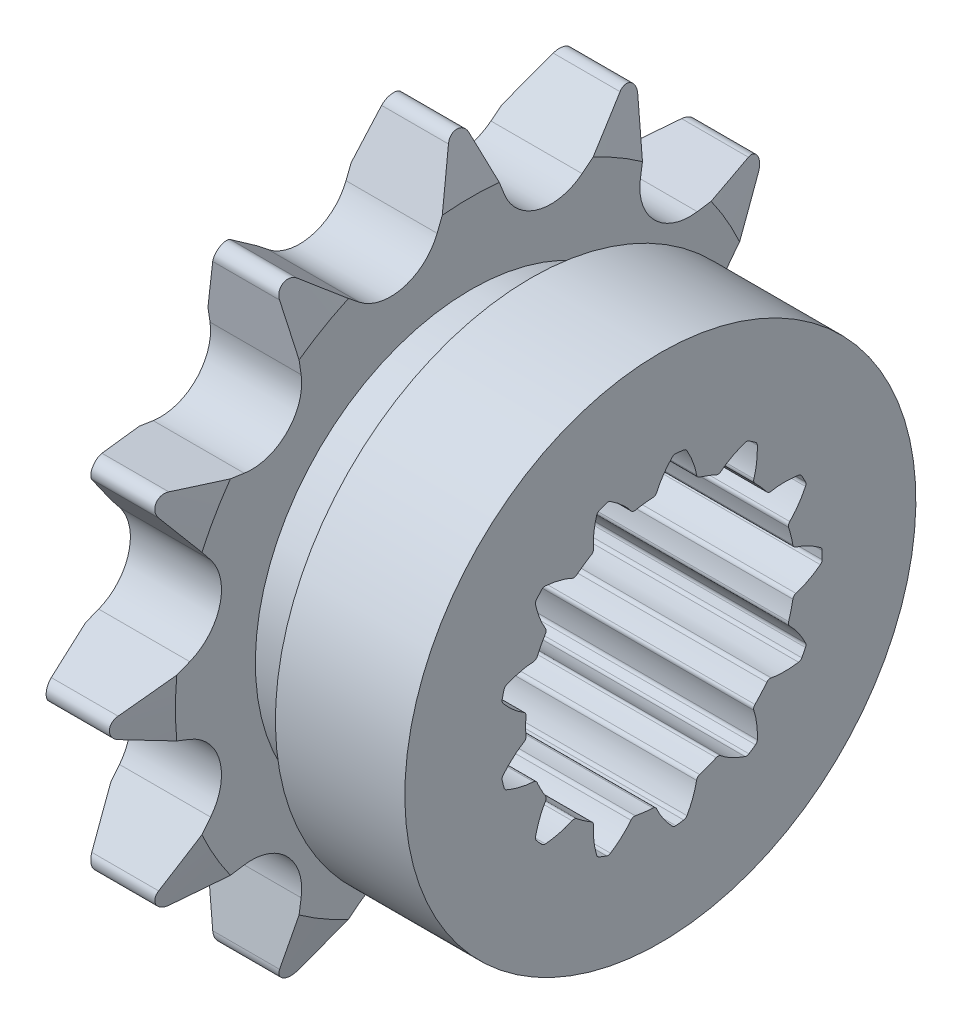
from build123d import *

# Parameters (mm, degrees)
SKETCH13_W            = 22.225
SKETCH13_H            = 27.5082
CUT_EXTRUDE1_DEPTH    = 7.2136
CIRPATTERN1_COUNT     = 12
SKETCH15_W            = 127
SKETCH15_H            = 22.5171
SKETCH16_W            = 4.7625
SKETCH16_H            = 3.175
SPLINE_CUT_DEPTH      = 45.803490606
SPLINE_CUT_DEPTH_BACK = 45.803490606


with BuildPart() as part:
    # Sketch13 → Revolve1 (revolve)
    with BuildSketch(Plane.XY):
        with Locations((11.1125, 13.7541)):
            Rectangle(SKETCH13_W, SKETCH13_H)
    revolve(axis=Axis((0, 0, 0), (-1, 0, 0)))

    # Sketch6 → Cut-Extrude1 (cut)
    with BuildSketch(Plane(origin=(0, -16.51, 0), x_dir=(0, 0, -1), z_dir=(1, 0, 0))):
        with BuildLine():
            Line((-0.805715716, 43.469749783), (-2.663822441, 38.756002806))
            ThreePointArc((-2.663822441, 38.756002806), (-5.324614334, 36.381731224), (-8.816063498, 37.107514783))
            Line((-8.816063498, 37.107514783), (-12.782104613, 40.260686049))
            ThreePointArc((-12.782104613, 40.260686049), (-13.256994885, 40.44645554), (-13.7541, 40.332800012))
            ThreePointArc((-13.7541, 40.332800012), (-7.119646056, 43.080880815), (0, 44.0182))
            ThreePointArc((0, 44.0182), (-0.487333422, 43.868076017), (-0.805715716, 43.469749783))
        make_face()
    cut_extrude1 = extrude(amount=CUT_EXTRUDE1_DEPTH, mode=Mode.SUBTRACT)

    # CirPattern1: Cut-Extrude1 ×12 about axis
    cirpattern1_axis = Axis((0, 0, 0), (1, 0, 0))
    for i in range(1, CIRPATTERN1_COUNT):
        add(cut_extrude1.rotate(cirpattern1_axis, i * 360 / CIRPATTERN1_COUNT), mode=Mode.SUBTRACT)

    # Sketch15 → hub Cut-Revolve3 (revolve, cut)
    with BuildSketch(Plane.XY):
        with Locations((70.7136, 31.48965)):
            Rectangle(SKETCH15_W, SKETCH15_H)
        with Locations((-63.5, 31.48965)):
            Rectangle(SKETCH15_W, SKETCH15_H)
    revolve(axis=Axis((0, 0, 0), (-1, 0, 0)), mode=Mode.SUBTRACT)

    # Sketch4 → Teeth Chamfer (revolve, cut)
    with BuildSketch(Plane.XY):
        Polygon((0, 27.5082), (1.104501883, 27.5082), (0, 23.386142857), align=None)
        Polygon((7.2136, 27.5082), (6.109098117, 27.5082), (7.2136, 23.386142857), align=None)
    revolve(axis=Axis((0, 0, 0), (-1, 0, 0)), mode=Mode.SUBTRACT)

    # Sketch16 → Recess (revolve, cut)
    with BuildSketch(Plane.XY):
        with Locations((9.59485, 18.6436)):
            Rectangle(SKETCH16_W, SKETCH16_H)
    revolve(axis=Axis((0, 0, 0), (-1, 0, 0)), mode=Mode.SUBTRACT)

    # Sketch31 → Spline Cut (cut, two sides: drawn at the far end of the back side and taken through both)
    with BuildSketch(Plane.ZY.offset(-SPLINE_CUT_DEPTH_BACK)):
        with BuildLine():
            ThreePointArc((9.096963927, -5.618057759), (9.432903718, -5.033652066), (9.731349847, -4.429238742))
            ThreePointArc((9.731349847, -4.429238742), (9.849186198, -4.242921184), (10.055031262, -4.164007003))
            add(Edge.make_bspline(
                [(10.055031262, -4.164007003), (10.154386976, -4.159463337), (10.336809192, -4.145821565), (10.601263254, -4.113038702), (10.945085741, -4.048420801), (11.269331323, -3.969271812), (11.618092873, -3.865601258), (11.882405473, -3.771842378), (12.065671025, -3.699742638), (12.17048809, -3.656196758)],
                knots=[0, 0, 0, 0, 0, 0.181968537, 0.334561157, 0.487153992, 0.639745397, 0.792336557, 1, 1, 1, 1, 1], degree=4, weights=[1, 1, 1, 1, 1, 1, 1, 1, 1, 1]))
            ThreePointArc((12.17048809, -3.656196758), (12.298958844, -3.564199425), (12.373875258, -3.425074393))
            ThreePointArc((12.373875258, -3.425074393), (12.453110239, -3.119814814), (12.524812347, -2.81269855))
            ThreePointArc((12.524812347, -2.81269855), (12.530965903, -2.775233666), (12.533025166, -2.737322676))
            ThreePointArc((12.533025166, -2.737322676), (12.512180636, -2.618340845), (12.452129872, -2.513531129))
            add(Edge.make_bspline(
                [(10.814977065, -1.08078568), (10.900840634, -1.130981798), (11.056027836, -1.227836819), (11.274955323, -1.379762533), (11.54936558, -1.59676112), (11.799688415, -1.817528504), (12.060323323, -2.071401795), (12.250788583, -2.277253351), (12.37955575, -2.426262248), (12.452129872, -2.513531129)],
                knots=[0, 0, 0, 0, 0, 0.181968537, 0.334561157, 0.487153992, 0.639745397, 0.792336557, 1, 1, 1, 1, 1], degree=4, weights=[1, 1, 1, 1, 1, 1, 1, 1, 1, 1]))
            ThreePointArc((10.814977065, -1.08078568), (10.682449044, -0.942686522), (10.642381645, -0.755524408))
            ThreePointArc((10.642381645, -0.755524408), (10.659820925, -0.403848256), (10.665636134, -0.051787995))
            ThreePointArc((10.665636134, -0.051787995), (10.659820925, 0.300272266), (10.642381645, 0.651948418))
            ThreePointArc((10.642381645, 0.651948418), (10.682449043, 0.839110529), (10.814977059, 0.977209687))
            add(Edge.make_bspline(
                [(10.814977059, 0.977209687), (10.900840628, 1.027405805), (11.056027831, 1.124260826), (11.274955318, 1.27618654), (11.549365574, 1.493185127), (11.799688409, 1.713952511), (12.060323317, 1.967825802), (12.250788577, 2.173677358), (12.379555744, 2.322686255), (12.452129867, 2.409955136)],
                knots=[0, 0, 0, 0, 0, 0.181968537, 0.334561157, 0.487153992, 0.639745397, 0.792336557, 1, 1, 1, 1, 1], degree=4, weights=[1, 1, 1, 1, 1, 1, 1, 1, 1, 1]))
            ThreePointArc((12.452129867, 2.409955136), (12.512180632, 2.514764857), (12.533025159, 2.633746695))
            ThreePointArc((12.533025159, 2.633746695), (12.530965896, 2.671657685), (12.524812341, 2.709122568))
            ThreePointArc((12.524812341, 2.709122568), (12.453110232, 3.016238833), (12.373875251, 3.321498411))
            ThreePointArc((12.373875251, 3.321498411), (12.298958837, 3.460623444), (12.170488083, 3.552620776))
            add(Edge.make_bspline(
                [(10.055031255, 4.060431021), (10.154386969, 4.055887356), (10.336809185, 4.042245584), (10.601263247, 4.009462721), (10.945085734, 3.944844819), (11.269331316, 3.865695831), (11.618092867, 3.762025276), (11.882405466, 3.668266396), (12.065671018, 3.596166656), (12.170488083, 3.552620776)],
                knots=[0, 0, 0, 0, 0, 0.181968537, 0.334561157, 0.487153992, 0.639745397, 0.792336557, 1, 1, 1, 1, 1], degree=4, weights=[1, 1, 1, 1, 1, 1, 1, 1, 1, 1]))
            ThreePointArc((10.055031255, 4.060431021), (9.873505642, 4.121122911), (9.75104915, 4.268226484))
            ThreePointArc((9.75104915, 4.268226484), (9.44459736, 4.902161031), (9.096963914, 5.514481778))
            ThreePointArc((9.096963914, 5.514481778), (9.045463263, 5.698825846), (9.098633115, 5.882695417))
            add(Edge.make_bspline(
                [(9.098633115, 5.882695417), (9.15133423, 5.967044663), (9.243734902, 6.124924613), (9.366982164, 6.361188829), (9.509116107, 6.68085634), (9.628170251, 6.992666973), (9.7409702, 7.338583689), (9.813954824, 7.609369809), (9.858724601, 7.801151721), (9.882429924, 7.912151354)],
                knots=[0, 0, 0, 0, 0, 0.181968537, 0.334561157, 0.487153992, 0.639745397, 0.792336557, 1, 1, 1, 1, 1], degree=4, weights=[1, 1, 1, 1, 1, 1, 1, 1, 1, 1]))
            ThreePointArc((9.882429924, 7.912151354), (9.888213448, 7.948497359), (9.890148422, 7.985249735))
            ThreePointArc((9.890148422, 7.985249735), (9.86890594, 8.10532677), (9.807757027, 8.21082818))
            ThreePointArc((9.807757027, 8.21082818), (9.601543918, 8.449444496), (9.389523627, 8.682916097))
            ThreePointArc((9.389523627, 8.682916097), (9.25853381, 8.771289802), (9.102025315, 8.793046058))
            add(Edge.make_bspline(
                [(6.992890131, 8.259587892), (7.082976794, 8.301737578), (7.250843292, 8.37443422), (7.500240691, 8.468304367), (7.834709819, 8.570870333), (8.158597393, 8.65147182), (8.515588518, 8.721753677), (8.793197627, 8.761566501), (8.988977633, 8.782893101), (9.102025315, 8.793046058)],
                knots=[0, 0, 0, 0, 0, 0.181968537, 0.334561157, 0.487153992, 0.639745397, 0.792336557, 1, 1, 1, 1, 1], degree=4, weights=[1, 1, 1, 1, 1, 1, 1, 1, 1, 1]))
            ThreePointArc((6.992890131, 8.259587892), (6.803952256, 8.228968733), (6.627159979, 8.302314108))
            ThreePointArc((6.627159979, 8.302314108), (6.06120632, 8.721220025), (5.468832551, 9.101849802))
            ThreePointArc((5.468832551, 9.101849802), (5.33756203, 9.241144822), (5.299193145, 9.428662504))
            add(Edge.make_bspline(
                [(5.299193145, 9.428662504), (5.306658616, 9.527841481), (5.315104876, 9.710577968), (5.314437452, 9.9770554), (5.291733909, 10.326159861), (5.252245491, 10.657581684), (5.191369372, 11.016296475), (5.130153463, 11.289983322), (5.080669632, 11.480603325), (5.050075552, 11.589905031)],
                knots=[0, 0, 0, 0, 0, 0.181968537, 0.334561157, 0.487153992, 0.639745397, 0.792336557, 1, 1, 1, 1, 1], degree=4, weights=[1, 1, 1, 1, 1, 1, 1, 1, 1, 1]))
            ThreePointArc((5.050075552, 11.589905031), (4.974234422, 11.728528142), (4.845153943, 11.819668001))
            ThreePointArc((4.845153943, 11.819668001), (4.551670772, 11.935120245), (4.255436465, 12.04331834))
            ThreePointArc((4.255436465, 12.04331834), (4.098381434, 12.060695366), (3.949689407, 12.00722645))
            add(Edge.make_bspline(
                [(2.330053321, 10.554708709), (2.390233163, 10.633895763), (2.505087752, 10.776276893), (2.682294549, 10.975295531), (2.930787473, 11.221548738), (3.180118298, 11.443435871), (3.463556634, 11.671569413), (3.690865349, 11.835833304), (3.854308971, 11.945700575), (3.949689407, 12.00722645)],
                knots=[0, 0, 0, 0, 0, 0.181968537, 0.334561157, 0.487153992, 0.639745397, 0.792336557, 1, 1, 1, 1, 1], degree=4, weights=[1, 1, 1, 1, 1, 1, 1, 1, 1, 1]))
            ThreePointArc((2.330053321, 10.554708709), (2.176986574, 10.439792982), (1.986359491, 10.422577618))
            ThreePointArc((1.986359491, 10.422577618), (1.290557128, 10.530488607), (0.589148727, 10.59222972))
            ThreePointArc((0.589148727, 10.59222972), (0.408180829, 10.654564882), (0.287063057, 10.802772633))
            add(Edge.make_bspline(
                [(0.287063057, 10.802772633), (0.247582634, 10.894060634), (0.170139547, 11.05979093), (0.045710334, 11.29543481), (-0.136629587, 11.594000596), (-0.325614245, 11.869108863), (-0.546220448, 12.158444493), (-0.727613063, 12.37233371), (-0.860014351, 12.518123057), (-0.9378991, 12.600687134)],
                knots=[0, 0, 0, 0, 0, 0.181968537, 0.334561157, 0.487153992, 0.639745397, 0.792336557, 1, 1, 1, 1, 1], degree=4, weights=[1, 1, 1, 1, 1, 1, 1, 1, 1, 1]))
            ThreePointArc((-0.9378991, 12.600687134), (-1.069474457, 12.688186671), (-1.226124349, 12.70890032))
            ThreePointArc((-1.226124349, 12.70890032), (-1.539644124, 12.674739775), (-1.852228739, 12.632877483))
            ThreePointArc((-1.852228739, 12.632877483), (-1.999369569, 12.575276963), (-2.106181575, 12.458831958))
            add(Edge.make_bspline(
                [(-2.865279455, 10.420008954), (-2.84879291, 10.518092574), (-2.813262034, 10.697540393), (-2.74884178, 10.95611475), (-2.643251794, 11.289641556), (-2.525596405, 11.601982666), (-2.380643166, 11.935705248), (-2.255708531, 12.186789328), (-2.162044258, 12.360028003), (-2.106181575, 12.458831958)],
                knots=[0, 0, 0, 0, 0, 0.181968537, 0.334561157, 0.487153992, 0.639745397, 0.792336557, 1, 1, 1, 1, 1], degree=4, weights=[1, 1, 1, 1, 1, 1, 1, 1, 1, 1]))
            ThreePointArc((-2.865279455, 10.420008954), (-2.947409327, 10.247122466), (-3.108200848, 10.143290196))
            ThreePointArc((-3.108200848, 10.143290196), (-3.774451981, 9.91548515), (-4.424210802, 9.644193453))
            ThreePointArc((-4.424210802, 9.644193453), (-4.613418511, 9.615288522), (-4.789538549, 9.690233734))
            add(Edge.make_bspline(
                [(-4.789538549, 9.690233734), (-4.866920376, 9.752717777), (-5.012511534, 9.863475068), (-5.232197301, 10.014302224), (-5.532401722, 10.193931511), (-5.827588513, 10.349702235), (-6.157386576, 10.503375397), (-6.417401036, 10.608467541), (-6.602388242, 10.676027651), (-6.709721201, 10.712939663)],
                knots=[0, 0, 0, 0, 0, 0.181968537, 0.334561157, 0.487153992, 0.639745397, 0.792336557, 1, 1, 1, 1, 1], degree=4, weights=[1, 1, 1, 1, 1, 1, 1, 1, 1, 1]))
            ThreePointArc((-6.709721201, 10.712939663), (-6.866888457, 10.729270538), (-7.01522116, 10.674812728))
            ThreePointArc((-7.01522116, 10.674812728), (-7.276953938, 10.498865164), (-7.534279491, 10.316532631))
            ThreePointArc((-7.534279491, 10.316532631), (-7.637797929, 10.19715015), (-7.678260572, 10.044405205))
            add(Edge.make_bspline(
                [(-7.40292007, 7.886346716), (-7.43390369, 7.980857128), (-7.485836221, 8.156262302), (-7.548960415, 8.415156109), (-7.610462761, 8.759549543), (-7.651436239, 9.090791046), (-7.678175138, 9.453650846), (-7.684235601, 9.734034777), (-7.681808034, 9.930957965), (-7.678260572, 10.044405205)],
                knots=[0, 0, 0, 0, 0, 0.181968537, 0.334561157, 0.487153992, 0.639745397, 0.792336557, 1, 1, 1, 1, 1], degree=4, weights=[1, 1, 1, 1, 1, 1, 1, 1, 1, 1]))
            ThreePointArc((-7.40292007, 7.886346716), (-7.389885405, 7.832521856), (-7.38550395, 7.777314784))
            ThreePointArc((-7.38550395, 7.777314784), (-7.412525738, 7.642462737), (-7.489418662, 7.528433224))
            ThreePointArc((-7.489418662, 7.528433224), (-7.973488458, 7.017099534), (-8.422745784, 6.474924686))
            ThreePointArc((-8.422745784, 6.474924686), (-8.576848099, 6.361401433), (-8.767623424, 6.34591506))
            add(Edge.make_bspline(
                [(-8.767623424, 6.34591506), (-8.865179412, 6.365280804), (-9.045565459, 6.395691931), (-9.31018042, 6.427149678), (-9.659476126, 6.446691562), (-9.993241314, 6.447439546), (-10.356678475, 6.430245572), (-10.6357486, 6.402465299), (-10.830943384, 6.376318964), (-10.943135867, 6.359122814)],
                knots=[0, 0, 0, 0, 0, 0.181968537, 0.334561157, 0.487153992, 0.639745397, 0.792336557, 1, 1, 1, 1, 1], degree=4, weights=[1, 1, 1, 1, 1, 1, 1, 1, 1, 1]))
            ThreePointArc((-10.943135867, 6.359122814), (-11.089889897, 6.30054382), (-11.195924177, 6.18339018))
            ThreePointArc((-11.195924177, 6.18339018), (-11.345910132, 5.905963062), (-11.48902644, 5.624930476))
            ThreePointArc((-11.48902644, 5.624930476), (-11.52520766, 5.471115122), (-11.490051435, 5.317062262))
            add(Edge.make_bspline(
                [(-10.243349742, 3.53415348), (-10.314705554, 3.603439488), (-10.442204376, 3.734618806), (-10.618412024, 3.934522612), (-10.832917256, 4.210886287), (-11.023133072, 4.485144748), (-11.215438548, 4.794014958), (-11.351105731, 5.039466162), (-11.440470995, 5.214961131), (-11.490051435, 5.317062262)],
                knots=[0, 0, 0, 0, 0, 0.181968537, 0.334561157, 0.487153992, 0.639745397, 0.792336557, 1, 1, 1, 1, 1], degree=4, weights=[1, 1, 1, 1, 1, 1, 1, 1, 1, 1]))
            ThreePointArc((-10.243349742, 3.53415348), (-10.164804896, 3.41936585), (-10.137168478, 3.283051063))
            ThreePointArc((-10.137168478, 3.283051063), (-10.141303219, 3.229411317), (-10.153609749, 3.177038922))
            ThreePointArc((-10.153609749, 3.177038922), (-10.344603652, 2.499316974), (-10.490440043, 1.810464698))
            ThreePointArc((-10.490440043, 1.810464698), (-10.57413398, 1.638329934), (-10.735860265, 1.535959717))
            add(Edge.make_bspline(
                [(-10.735860265, 1.535959717), (-10.831241512, 1.507770703), (-11.00509818, 1.450868843), (-11.254022236, 1.35575059), (-11.57238979, 1.210728261), (-11.868271791, 1.056282151), (-12.182088978, 0.872159973), (-12.416283165, 0.71787141), (-12.576968756, 0.60400844), (-12.668318816, 0.536643559)],
                knots=[0, 0, 0, 0, 0, 0.181968537, 0.334561157, 0.487153992, 0.639745397, 0.792336557, 1, 1, 1, 1, 1], degree=4, weights=[1, 1, 1, 1, 1, 1, 1, 1, 1, 1]))
            ThreePointArc((-12.668318816, 0.536643559), (-12.771040041, 0.416574438), (-12.810484721, 0.263563454))
            ThreePointArc((-12.810484721, 0.263563454), (-12.813394052, 0.105899652), (-12.814363878, -0.051788008))
            ThreePointArc((-12.814363878, -0.051788008), (-12.813394052, -0.209475668), (-12.810484721, -0.36713947))
            ThreePointArc((-12.810484721, -0.36713947), (-12.771040041, -0.520150453), (-12.668318816, -0.640219574))
            add(Edge.make_bspline(
                [(-10.735860265, -1.639535732), (-10.831241512, -1.611346719), (-11.00509818, -1.554444858), (-11.254022236, -1.459326606), (-11.57238979, -1.314304276), (-11.868271791, -1.159858167), (-12.182088978, -0.975735988), (-12.416283165, -0.821447425), (-12.576968756, -0.707584456), (-12.668318816, -0.640219574)],
                knots=[0, 0, 0, 0, 0, 0.181968537, 0.334561157, 0.487153992, 0.639745397, 0.792336557, 1, 1, 1, 1, 1], degree=4, weights=[1, 1, 1, 1, 1, 1, 1, 1, 1, 1]))
            ThreePointArc((-10.735860265, -1.639535732), (-10.574133976, -1.741905949), (-10.490440037, -1.914040716))
            ThreePointArc((-10.490440037, -1.914040716), (-10.344603646, -2.602892991), (-10.153609742, -3.280614939))
            ThreePointArc((-10.153609742, -3.280614939), (-10.141303212, -3.332987334), (-10.137168472, -3.38662708))
            ThreePointArc((-10.137168472, -3.38662708), (-10.164804889, -3.522941864), (-10.243349731, -3.637729493))
            add(Edge.make_bspline(
                [(-10.243349731, -3.637729493), (-10.314705544, -3.707015501), (-10.442204365, -3.838194818), (-10.618412013, -4.038098625), (-10.832917245, -4.3144623), (-11.023133061, -4.588720761), (-11.215438537, -4.897590971), (-11.351105721, -5.143042175), (-11.440470985, -5.318537144), (-11.490051425, -5.420638275)],
                knots=[0, 0, 0, 0, 0, 0.181968537, 0.334561157, 0.487153992, 0.639745397, 0.792336557, 1, 1, 1, 1, 1], degree=4, weights=[1, 1, 1, 1, 1, 1, 1, 1, 1, 1]))
            ThreePointArc((-11.490051425, -5.420638275), (-11.525207649, -5.574691135), (-11.489026429, -5.728506489))
            ThreePointArc((-11.489026429, -5.728506489), (-11.345910121, -6.009539075), (-11.195924166, -6.286966193))
            ThreePointArc((-11.195924166, -6.286966193), (-11.089889887, -6.404119833), (-10.943135857, -6.462698827))
            add(Edge.make_bspline(
                [(-8.767623413, -6.449491073), (-8.865179401, -6.468856817), (-9.045565449, -6.499267944), (-9.310180409, -6.530725691), (-9.659476115, -6.550267575), (-9.993241303, -6.551015559), (-10.356678464, -6.533821585), (-10.635748589, -6.506041312), (-10.830943374, -6.479894977), (-10.943135857, -6.462698827)],
                knots=[0, 0, 0, 0, 0, 0.181968537, 0.334561157, 0.487153992, 0.639745397, 0.792336557, 1, 1, 1, 1, 1], degree=4, weights=[1, 1, 1, 1, 1, 1, 1, 1, 1, 1]))
            ThreePointArc((-8.767623413, -6.449491073), (-8.576848085, -6.464977444), (-8.422745767, -6.578500698))
            ThreePointArc((-8.422745767, -6.578500698), (-7.973488441, -7.120675545), (-7.489418645, -7.632009235))
            ThreePointArc((-7.489418645, -7.632009235), (-7.412525721, -7.746038749), (-7.385503933, -7.880890795))
            ThreePointArc((-7.385503933, -7.880890795), (-7.389885388, -7.936097868), (-7.402920053, -7.989922727))
            add(Edge.make_bspline(
                [(-7.402920053, -7.989922727), (-7.433903673, -8.08443314), (-7.485836204, -8.259838314), (-7.548960398, -8.518732121), (-7.610462744, -8.863125554), (-7.651436222, -9.194367058), (-7.67817512, -9.557226858), (-7.684235584, -9.837610789), (-7.681808017, -10.034533976), (-7.678260555, -10.147981217)],
                knots=[0, 0, 0, 0, 0, 0.181968537, 0.334561157, 0.487153992, 0.639745397, 0.792336557, 1, 1, 1, 1, 1], degree=4, weights=[1, 1, 1, 1, 1, 1, 1, 1, 1, 1]))
            ThreePointArc((-7.678260555, -10.147981217), (-7.637797912, -10.300726162), (-7.534279474, -10.420108643))
            ThreePointArc((-7.534279474, -10.420108643), (-7.276953921, -10.602441175), (-7.015221143, -10.77838874))
            ThreePointArc((-7.015221143, -10.77838874), (-6.86688844, -10.83284655), (-6.709721184, -10.816515674))
            add(Edge.make_bspline(
                [(-4.789538532, -9.793809745), (-4.866920359, -9.856293788), (-5.012511517, -9.96705108), (-5.232197284, -10.117878235), (-5.532401705, -10.297507523), (-5.827588496, -10.453278246), (-6.157386559, -10.606951409), (-6.417401019, -10.712043553), (-6.602388225, -10.779603663), (-6.709721184, -10.816515674)],
                knots=[0, 0, 0, 0, 0, 0.181968537, 0.334561157, 0.487153992, 0.639745397, 0.792336557, 1, 1, 1, 1, 1], degree=4, weights=[1, 1, 1, 1, 1, 1, 1, 1, 1, 1]))
            ThreePointArc((-4.789538532, -9.793809745), (-4.613418492, -9.71886453), (-4.42421078, -9.747769461))
            ThreePointArc((-4.42421078, -9.747769461), (-3.774451958, -10.019061157), (-3.108200826, -10.246866204))
            ThreePointArc((-3.108200826, -10.246866204), (-2.947409307, -10.350698471), (-2.865279434, -10.523584955))
            add(Edge.make_bspline(
                [(-2.865279434, -10.523584955), (-2.848792889, -10.621668576), (-2.813262013, -10.801116394), (-2.748841759, -11.059690751), (-2.643251773, -11.393217557), (-2.525596384, -11.705558668), (-2.380643145, -12.03928125), (-2.25570851, -12.290365329), (-2.162044237, -12.463604005), (-2.106181554, -12.56240796)],
                knots=[0, 0, 0, 0, 0, 0.181968537, 0.334561157, 0.487153992, 0.639745397, 0.792336557, 1, 1, 1, 1, 1], degree=4, weights=[1, 1, 1, 1, 1, 1, 1, 1, 1, 1]))
            ThreePointArc((-2.106181554, -12.56240796), (-1.999369548, -12.678852964), (-1.852228718, -12.736453484))
            ThreePointArc((-1.852228718, -12.736453484), (-1.539644103, -12.778315776), (-1.226124328, -12.812476321))
            ThreePointArc((-1.226124328, -12.812476321), (-1.069474436, -12.791762673), (-0.937899079, -12.704263135))
            add(Edge.make_bspline(
                [(0.287063078, -10.906348634), (0.247582655, -10.997636635), (0.170139568, -11.163366931), (0.045710355, -11.399010811), (-0.136629566, -11.697576597), (-0.325614224, -11.972684865), (-0.546220427, -12.262020494), (-0.727613042, -12.475909711), (-0.86001433, -12.621699058), (-0.937899079, -12.704263135)],
                knots=[0, 0, 0, 0, 0, 0.181968537, 0.334561157, 0.487153992, 0.639745397, 0.792336557, 1, 1, 1, 1, 1], degree=4, weights=[1, 1, 1, 1, 1, 1, 1, 1, 1, 1]))
            ThreePointArc((0.287063078, -10.906348634), (0.40818085, -10.758140879), (0.58914875, -10.695805716))
            ThreePointArc((0.58914875, -10.695805716), (1.290557151, -10.634064602), (1.986359515, -10.526153614))
            ThreePointArc((1.986359515, -10.526153614), (2.176986595, -10.543368976), (2.330053341, -10.658284699))
            add(Edge.make_bspline(
                [(2.330053341, -10.658284699), (2.390233183, -10.737471753), (2.505087771, -10.879852884), (2.682294569, -11.078871521), (2.930787493, -11.325124729), (3.180118318, -11.547011861), (3.463556653, -11.775145403), (3.690865369, -11.939409294), (3.85430899, -12.049276566), (3.949689427, -12.11080244)],
                knots=[0, 0, 0, 0, 0, 0.181968537, 0.334561157, 0.487153992, 0.639745397, 0.792336557, 1, 1, 1, 1, 1], degree=4, weights=[1, 1, 1, 1, 1, 1, 1, 1, 1, 1]))
            ThreePointArc((3.949689427, -12.11080244), (4.098381454, -12.164271356), (4.255436485, -12.14689433))
            ThreePointArc((4.255436485, -12.14689433), (4.551670792, -12.038696236), (4.845153963, -11.923243991))
            ThreePointArc((4.845153963, -11.923243991), (4.974234441, -11.832104132), (5.050075571, -11.693481022))
            add(Edge.make_bspline(
                [(5.299193165, -9.532238494), (5.306658636, -9.631417472), (5.315104896, -9.814153958), (5.314437471, -10.08063139), (5.291733928, -10.429735851), (5.252245511, -10.761157674), (5.191369391, -11.119872465), (5.130153482, -11.393559313), (5.080669652, -11.584179315), (5.050075571, -11.693481022)],
                knots=[0, 0, 0, 0, 0, 0.181968537, 0.334561157, 0.487153992, 0.639745397, 0.792336557, 1, 1, 1, 1, 1], degree=4, weights=[1, 1, 1, 1, 1, 1, 1, 1, 1, 1]))
            ThreePointArc((5.299193165, -9.532238494), (5.337562047, -9.344720809), (5.46883257, -9.205425786))
            ThreePointArc((5.46883257, -9.205425786), (6.06120634, -8.824796009), (6.627159998, -8.405890092))
            ThreePointArc((6.627159998, -8.405890092), (6.803952272, -8.332544717), (6.992890145, -8.363163873))
            add(Edge.make_bspline(
                [(6.992890145, -8.363163873), (7.082976807, -8.40531356), (7.250843305, -8.478010201), (7.500240704, -8.571880348), (7.834709833, -8.674446314), (8.158597406, -8.755047801), (8.515588532, -8.825329658), (8.79319764, -8.865142483), (8.988977646, -8.886469082), (9.102025328, -8.896622039)],
                knots=[0, 0, 0, 0, 0, 0.181968537, 0.334561157, 0.487153992, 0.639745397, 0.792336557, 1, 1, 1, 1, 1], degree=4, weights=[1, 1, 1, 1, 1, 1, 1, 1, 1, 1]))
            ThreePointArc((9.102025328, -8.896622039), (9.258533823, -8.874865783), (9.38952364, -8.786492078))
            ThreePointArc((9.38952364, -8.786492078), (9.601543931, -8.553020477), (9.80775704, -8.314404161))
            ThreePointArc((9.80775704, -8.314404161), (9.868905953, -8.208902751), (9.890148435, -8.088825717))
            ThreePointArc((9.890148435, -8.088825717), (9.888213462, -8.05207334), (9.882429937, -8.015727335))
            add(Edge.make_bspline(
                [(9.098633128, -5.986271398), (9.151334243, -6.070620644), (9.243734915, -6.228500595), (9.366982177, -6.46476481), (9.509116121, -6.784432321), (9.628170265, -7.096242954), (9.740970213, -7.44215967), (9.813954838, -7.71294579), (9.858724614, -7.904727702), (9.882429937, -8.015727335)],
                knots=[0, 0, 0, 0, 0, 0.181968537, 0.334561157, 0.487153992, 0.639745397, 0.792336557, 1, 1, 1, 1, 1], degree=4, weights=[1, 1, 1, 1, 1, 1, 1, 1, 1, 1]))
            ThreePointArc((9.098633128, -5.986271398), (9.045463276, -5.802401827), (9.096963927, -5.618057759))
        make_face()
    extrude(amount=SPLINE_CUT_DEPTH + SPLINE_CUT_DEPTH_BACK, mode=Mode.SUBTRACT)


solid = part.part
